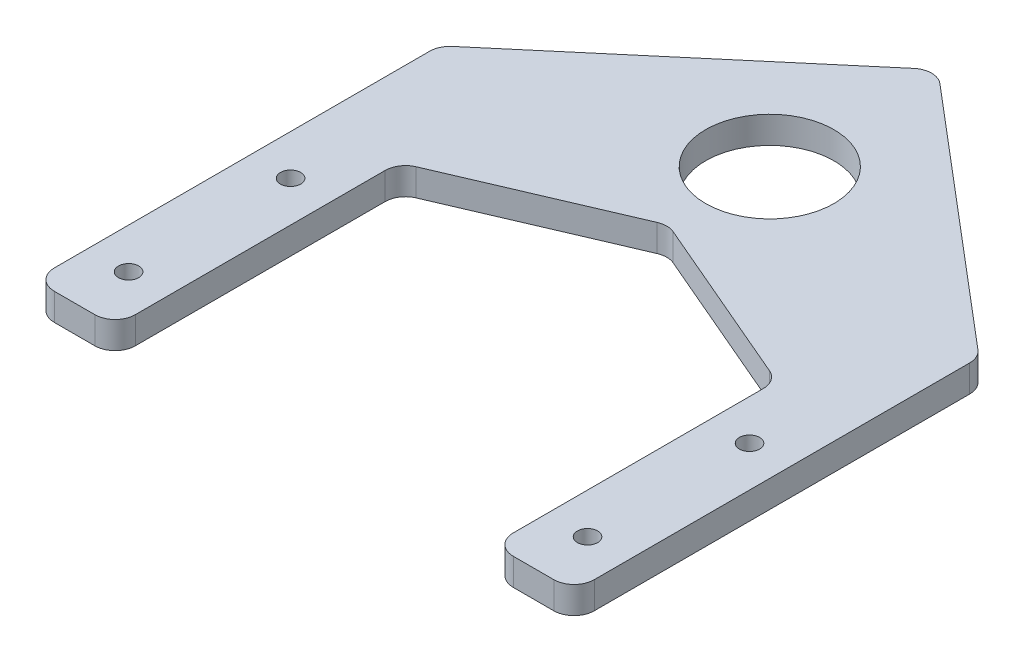
from build123d import *

# Parameters (mm, degrees)
SKETCH_2_R      = 1.5
SKETCH_2_R_2    = 9.5
EXTRUDE_1_DEPTH = 4
FILLET_1_R      = 3


with BuildPart() as part:
    # 草图2 → 凸台-拉伸1 (new body)
    with BuildSketch(Plane(origin=(0, 0, 0), x_dir=(1, 0, 0), z_dir=(0, 1, 0))):
        Polygon((0, 0), (0, 60), (40, 93.908128514), (80, 60), (80, 0), (68, 0), (68, 42), (40, 54), (12, 42), (12, 0), align=None)
        with Locations(Location((6, 32, 0), (0, 0, 270))):
            Circle(SKETCH_2_R, mode=Mode.SUBTRACT)
        with Locations(Location((6, 8, 0), (0, 0, 270))):
            Circle(SKETCH_2_R, mode=Mode.SUBTRACT)
        with Locations(Location((40, 69, 0), (0, 0, 270))):
            Circle(SKETCH_2_R_2, mode=Mode.SUBTRACT)
        with Locations(Location((74, 8, 0), (0, 0, 90))):
            Circle(SKETCH_2_R, mode=Mode.SUBTRACT)
        with Locations(Location((74, 32, 0), (0, 0, 90))):
            Circle(SKETCH_2_R, mode=Mode.SUBTRACT)
    extrude(amount=EXTRUDE_1_DEPTH)

    # 圆角1
    fillet_1_edges = [part.edges().sort_by_distance(p)[0] for p in [
        (0, 2, 0),
        (0, 2, -60),
        (40, 2, -93.908128514),
        (80, 2, -60),
        (80, 2, 0),
        (68, 2, 0),
        (68, 2, -42),
        (40, 2, -54),
        (12, 2, -42),
        (12, 2, 0),
    ]]
    fillet(fillet_1_edges, radius=FILLET_1_R)


solid = part.part
